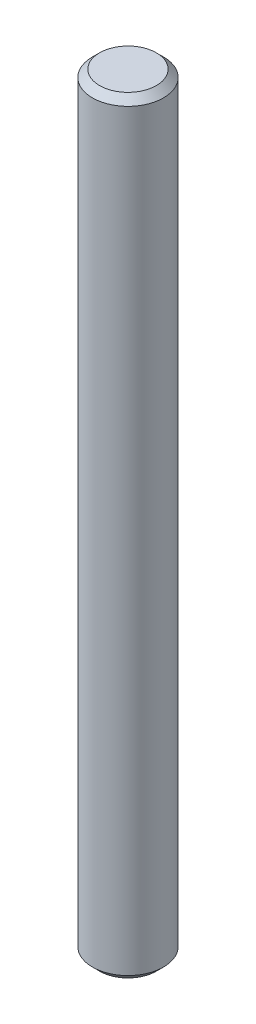
from build123d import *

# Parameters (mm, degrees)
CHAMFER_1_SIZE = 1


with BuildPart() as part:
    # 草图1 → 旋转1 (revolve)
    with BuildSketch(Plane.XY, mode=Mode.PRIVATE) as revolve_1_sk:
        Polygon((0, 54), (5, 54), (5, 15), (5, -15), (5, -54), (0, -54), align=None)
    revolve(revolve_1_sk.sketch.rotate(Axis((0, 54, 0), (0, -1, 0)), 180), axis=Axis((0, 54, 0), (0, -1, 0)))

    # 倒角1
    chamfer_1_edges = [part.edges().sort_by_distance(p)[0] for p in [
        (5, -54, 0),
        (5, 54, 0),
    ]]
    chamfer(chamfer_1_edges, length=CHAMFER_1_SIZE)


solid = part.part
